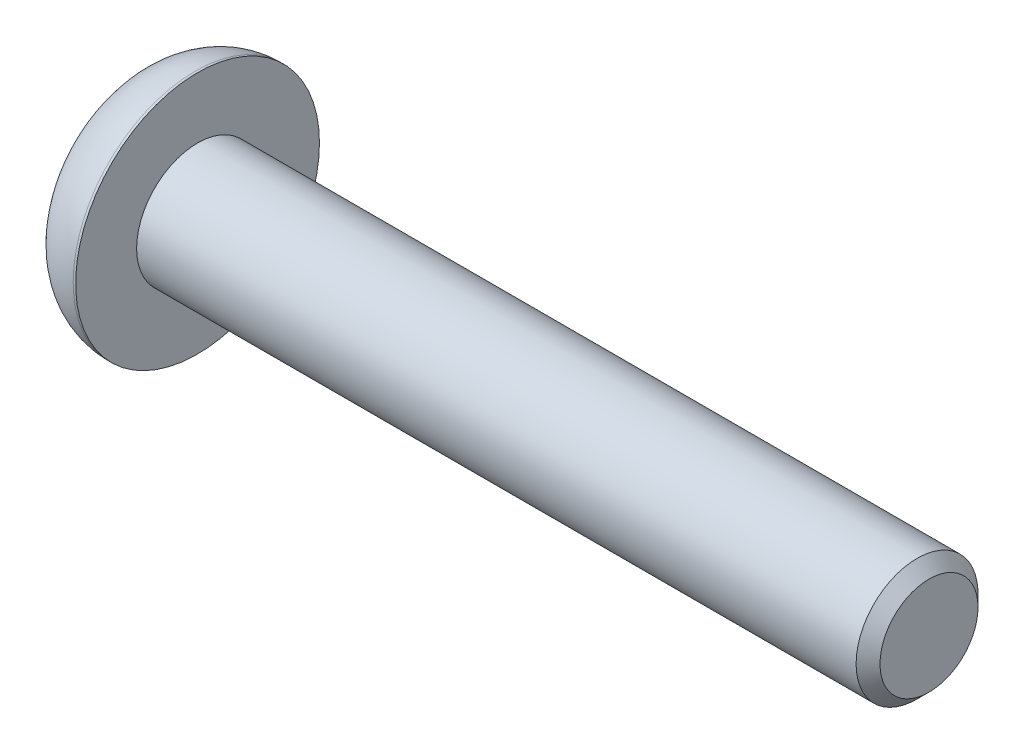
from build123d import *

# Parameters (mm, degrees)
SKETCH1_W                    = 2.8
SKETCH1_H                    = 5
SKETCH2_R                    = 2.5
BOSS_EXTRUDE1_DEPTH          = 30
CUT_EXTRUDE1_DEPTH           = 1.82
F_3_0_3_DIAMETER_HOLE1_D     = 3
F_3_0_3_DIAMETER_HOLE1_DEPTH = 0.113974596
F_3_0_3_DIAMETER_HOLE1_TIP   = 0.866025404
CHAMFER1_SIZE                = 0.4905
FILLET1_R                    = 2.7


with BuildPart() as part:
    # Sketch1 → Revolve1 (revolve)
    with BuildSketch(Plane.XY, mode=Mode.PRIVATE) as revolve1_sk:
        with Locations((1.4, 2.5)):
            Rectangle(SKETCH1_W, SKETCH1_H)
    revolve(revolve1_sk.sketch.rotate(Axis((0, 0, 0), (1, 0, 0)), 270), axis=Axis((0, 0, 0), (1, 0, 0)))

    # Sketch2 → Boss-Extrude1 (add)
    with BuildSketch(Plane(origin=(2.8, 0, 0), x_dir=(0, 0, -1), z_dir=(1, 0, 0))):
        with Locations(Location((0, 0, 0), (0, 0, 180))):
            Circle(SKETCH2_R)
    extrude(amount=BOSS_EXTRUDE1_DEPTH)

    # Sketch3 → Cut-Extrude1 (cut)
    with BuildSketch(Plane.ZY):
        Polygon((1.5, -0.866025404), (1.5, 0.866025404), (0, 1.732050808), (-1.5, 0.866025404), (-1.5, -0.866025404), (0, -1.732050808), align=None)
    extrude(amount=-CUT_EXTRUDE1_DEPTH, mode=Mode.SUBTRACT)

    # Ø3.0 (3) Diameter Hole1
    with Locations(Plane.ZY.offset(-1.82)):
        with Locations((0, 0)):
            Hole(F_3_0_3_DIAMETER_HOLE1_D / 2, depth=F_3_0_3_DIAMETER_HOLE1_DEPTH)
            with Locations((0, 0, -(F_3_0_3_DIAMETER_HOLE1_DEPTH + F_3_0_3_DIAMETER_HOLE1_TIP / 2))):  # 120° drill point
                Cone(0, F_3_0_3_DIAMETER_HOLE1_D / 2, F_3_0_3_DIAMETER_HOLE1_TIP, mode=Mode.SUBTRACT)

    # Chamfer1
    chamfer1_edges = [part.edges().sort_by_distance(p)[0] for p in [
        (32.8, 0, -2.5),
    ]]
    chamfer(chamfer1_edges, length=CHAMFER1_SIZE)

    # Fillet1
    fillet1_edges = [part.edges().sort_by_distance(p)[0] for p in [
        (0, 0, 5),
    ]]
    fillet(fillet1_edges, radius=FILLET1_R)


solid = part.part
